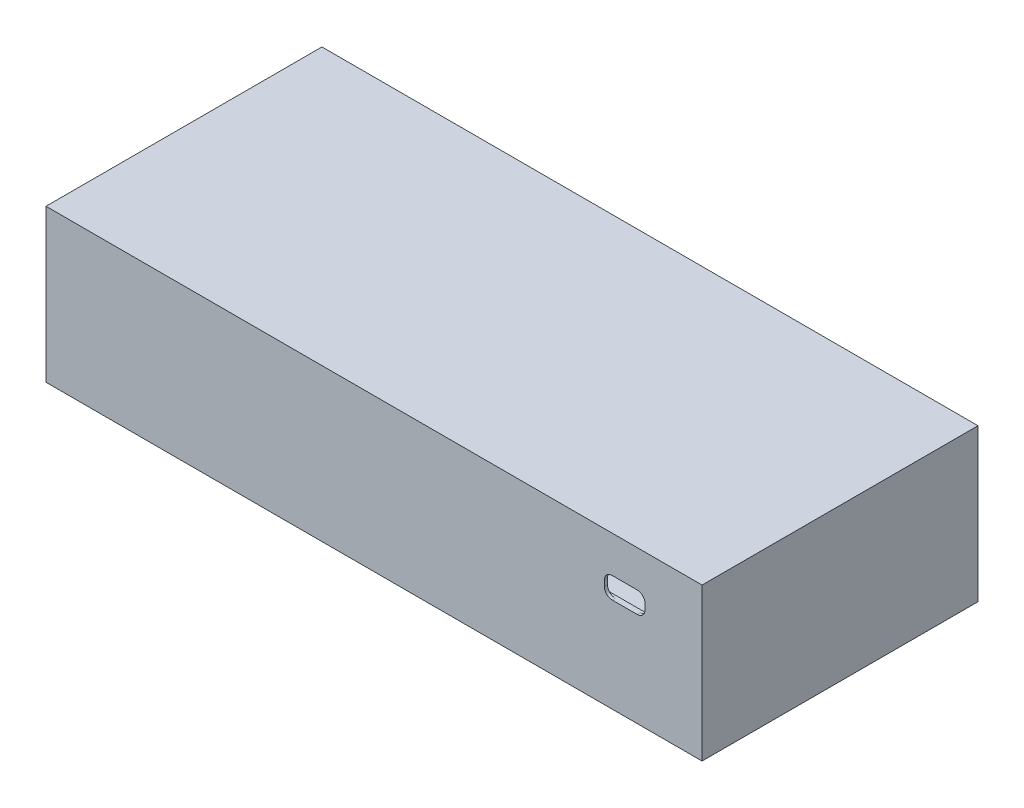
from build123d import *

# Parameters (mm, degrees)
SKETCH1_W            = 50
SKETCH1_H            = 71.5
BOSS_EXTRUDE1_DEPTH  = 2
SKETCH2_W            = 23
SKETCH2_H            = 12.5
CUT_EXTRUDE1_DEPTH   = 3
SKETCH3_R            = 1.25
CUT_EXTRUDE2_DEPTH   = 3
SKETCH14_W           = 120
SKETCH14_H           = 71.5
BOSS_EXTRUDE7_DEPTH  = 2
SKETCH15_W           = 170
SKETCH15_H           = 1.5
BOSS_EXTRUDE8_DEPTH  = 37.5
SKETCH16_W           = 1.8
SKETCH16_H           = 68.5
BOSS_EXTRUDE9_DEPTH  = 37.5
SKETCH17_W           = 168.2
SKETCH17_H           = 5.5
CUT_EXTRUDE3_DEPTH   = 0.7
SKETCH18_W           = 10.5
SKETCH18_H           = 2.75
CUT_EXTRUDE4_DEPTH   = 1
FILLET4_R            = 2
SKETCH19_W           = 68.5
SKETCH19_H           = 2.5
BOSS_EXTRUDE10_DEPTH = 168.2
CHAMFER1_SIZE        = 0.5


with BuildPart() as part:
    # Sketch1 → Boss-Extrude1 (new body)
    with BuildSketch(Plane(origin=(0, 0, 0), x_dir=(1, 0, 0), z_dir=(0, 1, 0))):
        Rectangle(SKETCH1_W, SKETCH1_H)
    extrude(amount=BOSS_EXTRUDE1_DEPTH)

    # Sketch2 → Cut-Extrude1 (cut)
    with BuildSketch(Plane(origin=(0, 2, 0), x_dir=(1, 0, 0), z_dir=(0, 1, 0))):
        Rectangle(SKETCH2_W, SKETCH2_H)
    extrude(amount=-CUT_EXTRUDE1_DEPTH, mode=Mode.SUBTRACT)

    # Sketch3 → Cut-Extrude2 (cut)
    with BuildSketch(Plane(origin=(0, 2, 0), x_dir=(1, 0, 0), z_dir=(0, 1, 0))):
        with Locations(Location((-13.9, 0, 0), (0, 0, 270))):
            Circle(SKETCH3_R)
        with Locations(Location((13.9, 0, 0), (0, 0, 270))):
            Circle(SKETCH3_R)
    extrude(amount=-CUT_EXTRUDE2_DEPTH, mode=Mode.SUBTRACT)

    # Sketch14 → Boss-Extrude7 (add)
    with BuildSketch(Plane.XZ):
        with Locations((-85, 0)):
            Rectangle(SKETCH14_W, SKETCH14_H)
    extrude(amount=-BOSS_EXTRUDE7_DEPTH)

    # Sketch15 → Boss-Extrude8 (add)
    with BuildSketch(Plane(origin=(0, 2, 0), x_dir=(1, 0, 0), z_dir=(0, 1, 0))):
        with Locations((-60, -35)):
            Rectangle(SKETCH15_W, SKETCH15_H)
        with Locations((-60, 35)):
            Rectangle(SKETCH15_W, SKETCH15_H)
    extrude(amount=BOSS_EXTRUDE8_DEPTH)

    # Sketch16 → Boss-Extrude9 (add)
    with BuildSketch(Plane(origin=(0, 2, 0), x_dir=(1, 0, 0), z_dir=(0, 1, 0))):
        with Locations((24.1, 0)):
            Rectangle(SKETCH16_W, SKETCH16_H)
    extrude(amount=BOSS_EXTRUDE9_DEPTH)

    # Sketch17 → Cut-Extrude3 (cut)
    with BuildSketch(Plane(origin=(0, 0, 34.25), x_dir=(-1, 0, 0), z_dir=(0, 0, -1))):
        with Locations((60.9, 27.25)):
            Rectangle(SKETCH17_W, SKETCH17_H)
    extrude(amount=-CUT_EXTRUDE3_DEPTH, mode=Mode.SUBTRACT)

    # Sketch18 → Cut-Extrude4 (cut)
    with BuildSketch(Plane(origin=(0, 0, 34.95), x_dir=(-1, 0, 0), z_dir=(0, 0, -1))):
        with Locations((-4.95, 28.625)):
            Rectangle(SKETCH18_W, SKETCH18_H)
        with Locations((-4.95, 25.875)):
            Rectangle(SKETCH18_W, SKETCH18_H)
    extrude(amount=-CUT_EXTRUDE4_DEPTH, mode=Mode.SUBTRACT)

    # Fillet4
    fillet4_edges = [part.edges().sort_by_distance(p)[0] for p in [
        (10.2, 24.5, 35.35),
        (10.2, 30, 35.35),
        (-0.3, 30, 35.35),
        (-0.3, 24.5, 35.35),
    ]]
    fillet(fillet4_edges, radius=FILLET4_R)

    # Sketch19 → Boss-Extrude10 (add)
    with BuildSketch(Plane.ZY.offset(-23.2)):
        with Locations((0, 38.25)):
            Rectangle(SKETCH19_W, SKETCH19_H)
    extrude(amount=BOSS_EXTRUDE10_DEPTH)

    # Chamfer1
    chamfer1_edges = [part.edges().sort_by_distance(p)[0] for p in [
        (-60.9, 30, 34.25),
    ]]
    chamfer(chamfer1_edges, length=CHAMFER1_SIZE)


solid = part.part
